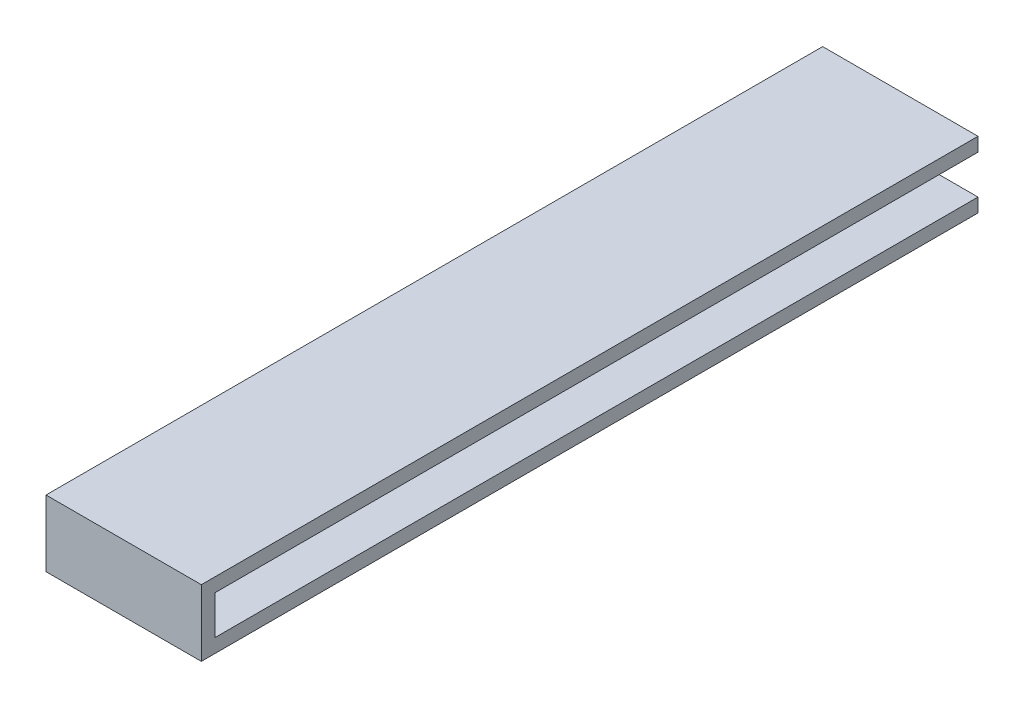
from build123d import *

# Parameters (mm, degrees)
SKETCH1_W           = 0.4
SKETCH1_H           = 2
BOSS_EXTRUDE2_DEPTH = 0.03556
SKETCH2_W           = 0.4
SKETCH2_H           = 0.03556
BOSS_EXTRUDE3_DEPTH = 0.13556
SKETCH4_W           = 0.4
SKETCH4_H           = 0.03556
BOSS_EXTRUDE4_DEPTH = 1.96444


with BuildPart() as part:
    # Sketch1 → Boss-Extrude2 (new body)
    with BuildSketch(Plane(origin=(0, 0, 0), x_dir=(1, 0, 0), z_dir=(0, 1, 0))):
        with Locations((-0.2, 1)):
            Rectangle(SKETCH1_W, SKETCH1_H)
    extrude(amount=BOSS_EXTRUDE2_DEPTH)

    # Sketch2 → Boss-Extrude3 (add)
    with BuildSketch(Plane(origin=(0, 0.03556, 0), x_dir=(1, 0, 0), z_dir=(0, 1, 0))):
        with Locations((-0.2, 0.01778)):
            Rectangle(SKETCH2_W, SKETCH2_H)
    extrude(amount=BOSS_EXTRUDE3_DEPTH)

    # Sketch4 → Boss-Extrude4 (add)
    with BuildSketch(Plane(origin=(0, 0, -0.03556), x_dir=(-1, 0, 0), z_dir=(0, 0, -1))):
        with Locations((0.2, 0.15334)):
            Rectangle(SKETCH4_W, SKETCH4_H)
    extrude(amount=BOSS_EXTRUDE4_DEPTH)


solid = part.part
